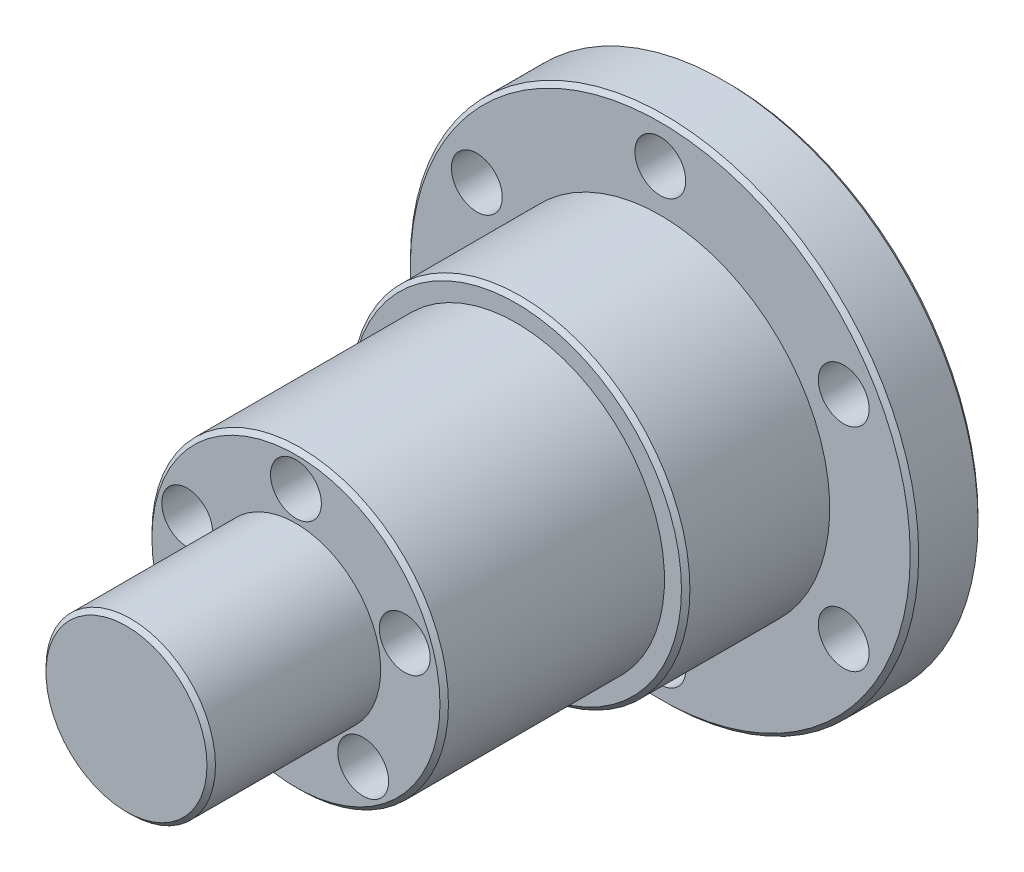
from build123d import *

# Parameters (mm, degrees)
SKETCH_2_R                   = 3
CUT_EXTRUDE_1_DEPTH          = 10
HOLE_WIZARD_M6_2_D           = 6
HOLE_WIZARD_M6_2_CBORE_D     = 10
HOLE_WIZARD_M6_2_CBORE_DEPTH = 6
PATTERN_CIRCULAR_1_COUNT     = 5
CHAMFER_1_SIZE               = 0.5


with BuildPart() as part:
    # 草图1 → 旋转1 (revolve)
    with BuildSketch(Plane(origin=(0, 0, 0), x_dir=(0, 0, -1), z_dir=(1, 0, 0)), mode=Mode.PRIVATE) as revolve_1_sk:
        Polygon((0, 0), (0, 10), (20, 10), (20, 17.5), (46, 17.5), (46, 20), (63, 20), (63, 30), (71, 30), (71, 0), align=None)
    revolve(revolve_1_sk.sketch.rotate(Axis((0, 0, 0), (0, 0, 1)), 90), axis=Axis((0, 0, 0), (0, 0, 1)))

    # 草图2 → 切除-拉伸1 (cut)
    with BuildSketch(Plane(origin=(0, 0, -71), x_dir=(-1, 0, 0), z_dir=(0, 0, -1))):
        with Locations((0, 25)):
            Circle(SKETCH_2_R)
        with Locations((21.650635095, 12.5)):
            Circle(SKETCH_2_R)
        with Locations((21.650635095, -12.5)):
            Circle(SKETCH_2_R)
        with Locations((0, -25)):
            Circle(SKETCH_2_R)
        with Locations((-21.650635095, -12.5)):
            Circle(SKETCH_2_R)
        with Locations((-21.650635095, 12.5)):
            Circle(SKETCH_2_R)
    extrude(amount=-CUT_EXTRUDE_1_DEPTH, mode=Mode.SUBTRACT)

    # M6 六角头螺栓的柱形沉头孔2 (through all)
    with Locations(Plane(origin=(0, 0, -71), x_dir=(-1, 0, 0), z_dir=(0, 0, -1))):
        with Locations((0, 13.5)):
            hole_wizard_m6_2 = CounterBoreHole(HOLE_WIZARD_M6_2_D / 2, HOLE_WIZARD_M6_2_CBORE_D / 2, HOLE_WIZARD_M6_2_CBORE_DEPTH)

    # 阵列(圆周)1: M6 六角头螺栓的柱形沉头孔2 ×5 about axis
    pattern_circular_1_axis = Axis((0, 0, 0), (0, 0, 1))
    for i in range(1, PATTERN_CIRCULAR_1_COUNT):
        add(hole_wizard_m6_2.rotate(pattern_circular_1_axis, i * 360 / PATTERN_CIRCULAR_1_COUNT), mode=Mode.SUBTRACT)

    # 倒角1
    chamfer_1_edges = [part.edges().sort_by_distance(p)[0] for p in [
        (17.5, 0, -20),
        (10, 0, 0),
        (30, 0, -71),
        (30, 0, -63),
        (20, 0, -46),
    ]]
    chamfer(chamfer_1_edges, length=CHAMFER_1_SIZE)


solid = part.part
